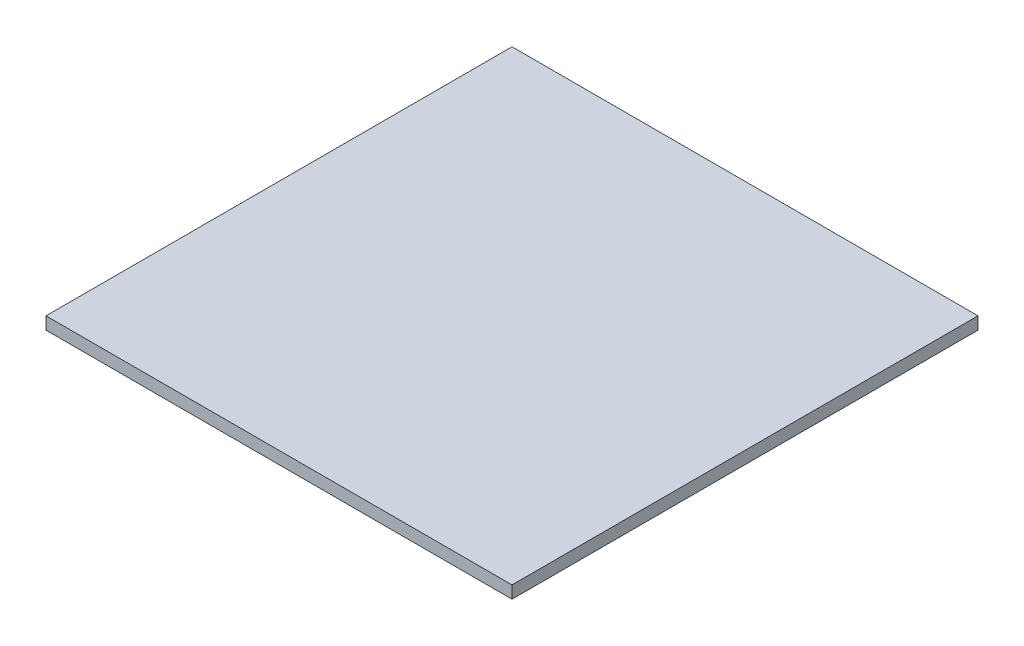
from build123d import *

# Parameters (mm, degrees)
OVEN_DAMLALIK_TAVASI_1_START = -150
SKETCH1_W                    = 300
SKETCH1_H                    = 8
OVEN_DAMLALIK_TAVASI_1_DEPTH = 300


with BuildPart() as part:
    # Sketch1 → OVEN_damlalik_tavasi_1 (new body)
    with BuildSketch(Plane.XY.offset(OVEN_DAMLALIK_TAVASI_1_START)):
        with Locations((350, 866)):
            Rectangle(SKETCH1_W, SKETCH1_H)
    extrude(amount=-OVEN_DAMLALIK_TAVASI_1_DEPTH)


solid = part.part
